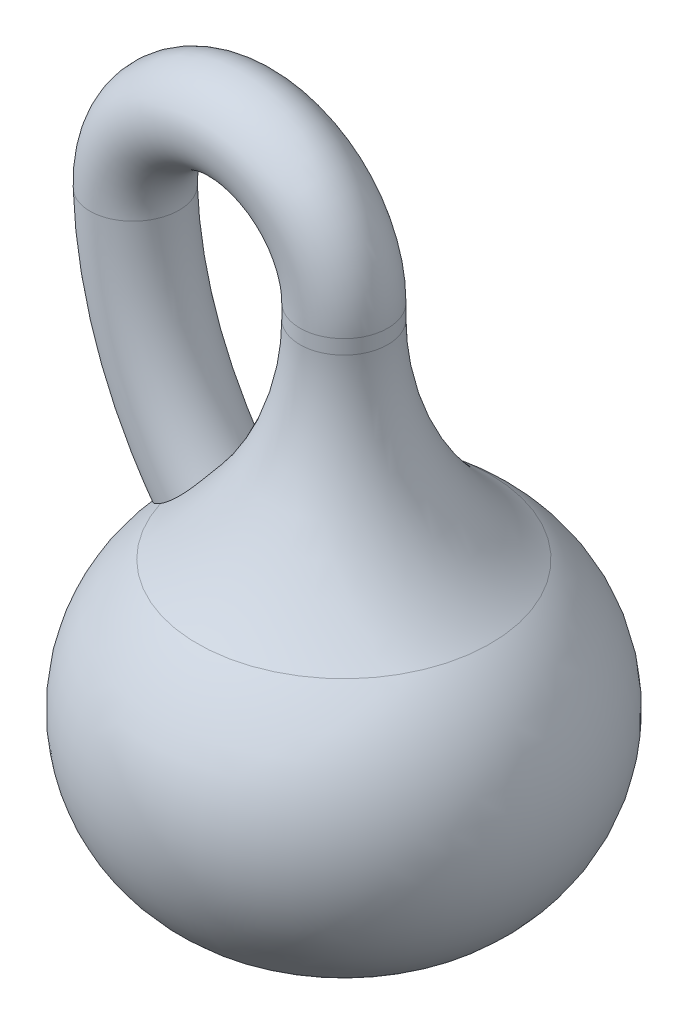
from build123d import *

# Parameters (mm, degrees)
CUT_SWEEP1_PROFILE_R     = 15
SWEEP_THIN12_PROFILE_R   = 15
SWEEP_THIN12_PROFILE_R_2 = 13


with BuildPart() as part:
    # Sketch1 → Revolve-Thin1 (revolve)
    with BuildSketch(Plane.XY, mode=Mode.PRIVATE) as revolve_thin1_sk:
        with BuildLine():
            ThreePointArc((15, 158.047911596), (24.233552452, 118.497737071), (50.025144573, 87.124682204))
            ThreePointArc((50.025144573, 87.124682204), (71.88454025, 43.999145941), (51.841581044, 0))
            ThreePointArc((51.841581044, 0), (26.638116777, -3.259110425), (13, 18.184727444))
            Line((13, 18.184727444), (13, 19.931198036))
            Line((13, 19.931198036), (15, 19.931198036))
            Line((15, 19.931198036), (15, 18.184727444))
            ThreePointArc((15, 18.184727444), (27.486133236, -1.447793753), (50.560712958, 1.536026349))
            ThreePointArc((50.560712958, 1.536026349), (69.884974777, 43.957457598), (48.80940999, 85.536604931))
            ThreePointArc((48.80940999, 85.536604931), (22.440305514, 117.61214946), (13, 158.047911596))
            Line((13, 158.047911596), (15, 158.047911596))
        make_face()
    revolve(revolve_thin1_sk.sketch.rotate(Axis((0, 0, 0), (0, 1, 0)), 90), axis=Axis((0, 0, 0), (0, 1, 0)))

    # Cut-Sweep1: sweep along a path in Sketch129
    with BuildLine(Plane.XY) as cut_sweep1_path:
        Line((0, 19.931198036), (0, 35.124067718))
        ThreePointArc((0, 35.124067718), (-3.022249702, 47.010249867), (-11.354892509, 56.009271103))
        ThreePointArc((-11.354892509, 56.009271103), (-54.233457152, 101.503338373), (-71.240570979, 161.661791991))
        ThreePointArc((-71.240570979, 161.661791991), (-36.261502155, 198.5476008), (0, 162.921744899))
        Line((0, 162.921744899), (0, 158.047911596))
    # Cut-Sweep1 profile (on start of the path) → Cut-Sweep1 (sweep, cut)
    with BuildSketch(Plane(origin=(0, 19.931198036, 0), x_dir=(1, 0, 0), z_dir=(0, 1, 0))):
        Circle(CUT_SWEEP1_PROFILE_R)
    sweep(path=cut_sweep1_path.line, mode=Mode.SUBTRACT)

    # Sweep-Thin12: sweep along a path in Sketch129<9>
    with BuildLine(Plane.XY) as sweep_thin12_path:
        Line((0, 19.931198036), (0, 35.124067718))
        ThreePointArc((0, 35.124067718), (-3.022249702, 47.010249867), (-11.354892509, 56.009271103))
        ThreePointArc((-11.354892509, 56.009271103), (-54.233457152, 101.503338373), (-71.240570979, 161.661791991))
        ThreePointArc((-71.240570979, 161.661791991), (-36.261502155, 198.5476008), (0, 162.921744899))
        Line((0, 162.921744899), (0, 158.047911596))
    # Sweep-Thin12 profile (on start of the path) → Sweep-Thin12 (sweep)
    with BuildSketch(Plane(origin=(0, 19.931198036, 0), x_dir=(1, 0, 0), z_dir=(0, 1, 0))):
        Circle(SWEEP_THIN12_PROFILE_R)
        Circle(SWEEP_THIN12_PROFILE_R_2, mode=Mode.SUBTRACT)
    sweep(path=sweep_thin12_path.line)


solid = part.part
